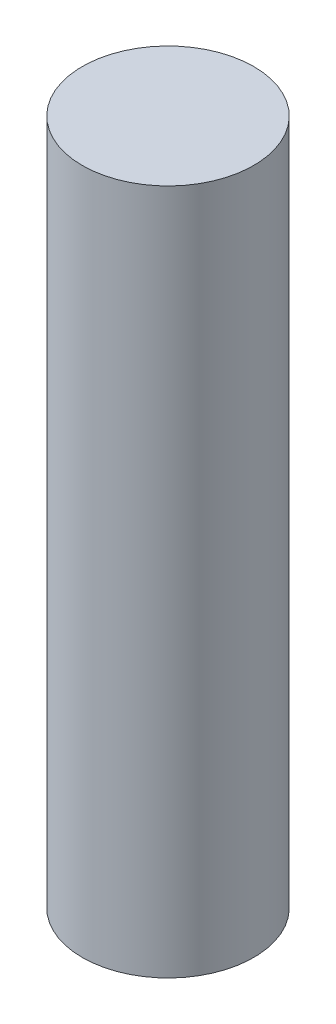
from build123d import *

# Parameters (mm, degrees)
SKETCH1_R           = 1.5
BOSS_EXTRUDE1_DEPTH = 12


with BuildPart() as part:
    # Sketch1 → Boss-Extrude1 (new body)
    with BuildSketch(Plane(origin=(0, 0, 0), x_dir=(1, 0, 0), z_dir=(0, 1, 0))):
        with Locations(Location((0, 0, 0), (0, 0, 270))):
            Circle(SKETCH1_R)
    extrude(amount=BOSS_EXTRUDE1_DEPTH)


solid = part.part
